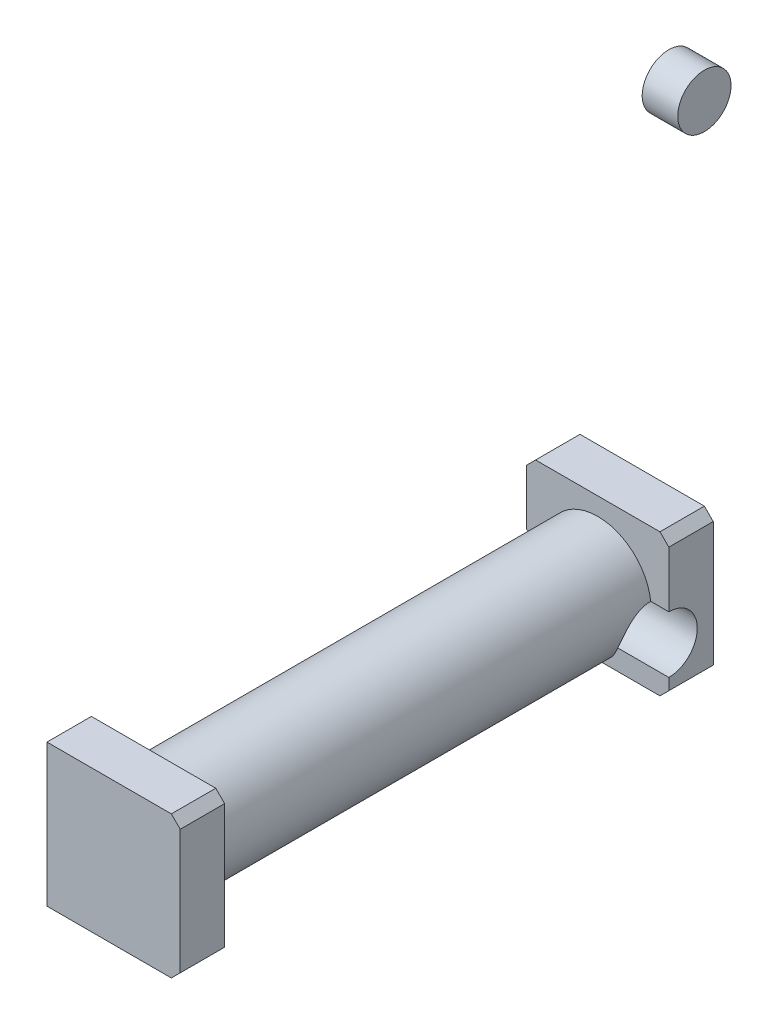
from build123d import *

# Parameters (mm, degrees)
SKETCH1_R           = 30
BOSS_EXTRUDE1_DEPTH = 250
SKETCH2_W           = 80
SKETCH2_H           = 80
BOSS_EXTRUDE2_DEPTH = 25
SKETCH3_R           = 16
CUT_EXTRUDE1_DEPTH  = 80
CHAMFER1_SIZE       = 5
SKETCH5_W           = 80
SKETCH5_H           = 80
BOSS_EXTRUDE3_DEPTH = 25
SKETCH6_R           = 15
BOSS_EXTRUDE4_DEPTH = 20
CHAMFER4_SIZE       = 5


with BuildPart() as part:
    # Sketch1 → Boss-Extrude1 (new body)
    with BuildSketch(Plane.XY):
        Circle(SKETCH1_R)
    extrude(amount=BOSS_EXTRUDE1_DEPTH)

    # Sketch2 → Boss-Extrude2 (add)
    with BuildSketch(Plane.XY):
        Rectangle(SKETCH2_W, SKETCH2_H)
    extrude(amount=-BOSS_EXTRUDE2_DEPTH)

    # Sketch3 → Cut-Extrude1 (cut)
    with BuildSketch(Plane(origin=(-40, 0, 0), x_dir=(0, 0, -1), z_dir=(1, 0, 0))):
        with Locations((0, -12.5)):
            Circle(SKETCH3_R)
    extrude(amount=CUT_EXTRUDE1_DEPTH, mode=Mode.SUBTRACT)

    # Chamfer1
    chamfer1_edges = [part.edges().sort_by_distance(p)[0] for p in [
        (40, 40, -12.5),
        (40, -40, -12.5),
        (-40, 40, -12.5),
        (-40, -40, -12.5),
    ]]
    chamfer(chamfer1_edges, length=CHAMFER1_SIZE)

    # Sketch5 → Boss-Extrude3 (add)
    with BuildSketch(Plane.XY.offset(250)):
        Rectangle(SKETCH5_W, SKETCH5_H)
    extrude(amount=BOSS_EXTRUDE3_DEPTH)

    # Chamfer4
    chamfer4_edges = [part.edges().sort_by_distance(p)[0] for p in [
        (40, 40, 262.5),
        (40, -40, 262.5),
        (-40, 40, 262.5),
        (-40, 0, 275),
    ]]
    chamfer(chamfer4_edges, length=CHAMFER4_SIZE)


with BuildPart() as body_2:
    # Sketch6 → Boss-Extrude4 (new body)
    with BuildSketch(Plane(origin=(40, 0, 0), x_dir=(0, 0, -1), z_dir=(1, 0, 0))):
        with Locations((0, 262.5)):
            Circle(SKETCH6_R)
    extrude(amount=BOSS_EXTRUDE4_DEPTH)


solid = Compound([part.part, body_2.part])
